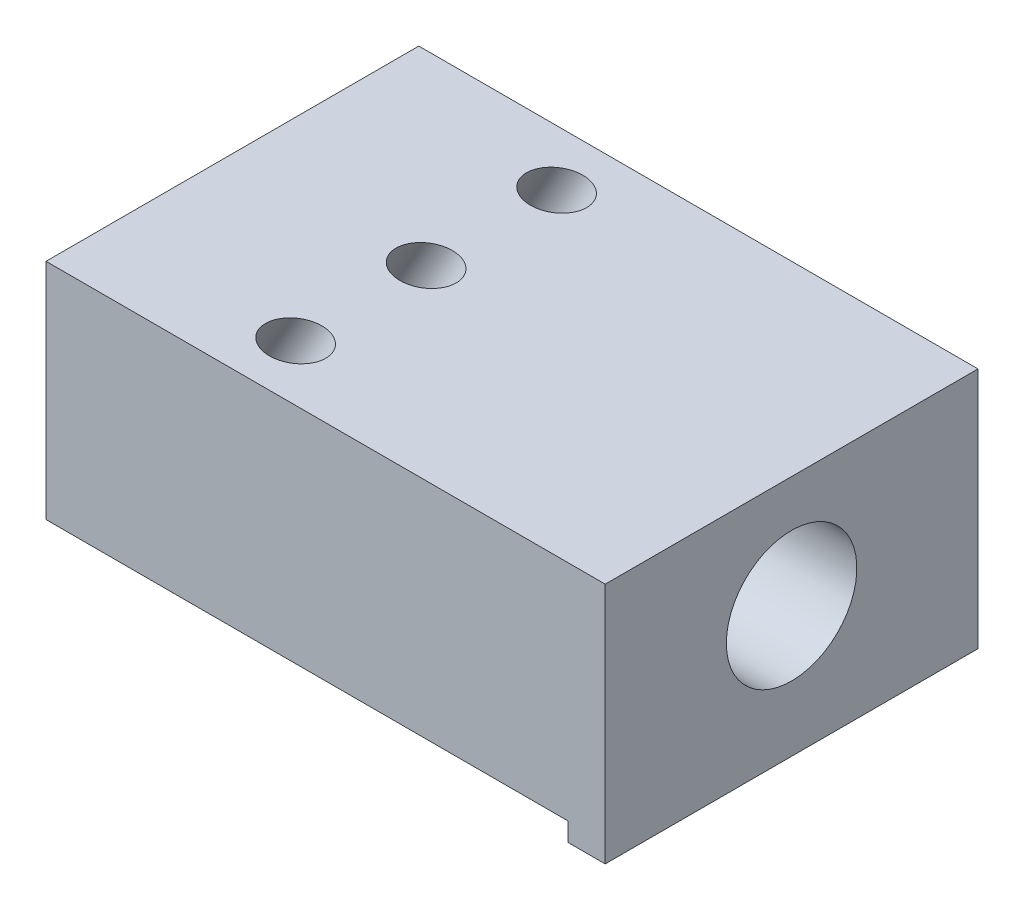
from build123d import *

# Parameters (mm, degrees)
SKICA1_W                 = 30
SKICA1_H                 = 12
SKICA1_W_2               = 2
SKICA1_H_2               = 1
P_IDAT_VYSUNUT_M1_DEPTH  = 20
SKICA2_R                 = 3.5
ODEBRAT_VYSUNUT_M1_DEPTH = 34
SKICA3_R                 = 1.4
ODEBRAT_VYSUNUT_M2_DEPTH = 34


with BuildPart() as part:
    # Skica1 → Přidat vysunutím1 (new body)
    with BuildSketch(Plane.XY):
        with Locations((15, 6)):
            Rectangle(SKICA1_W, SKICA1_H)
        with Locations((29, -0.5)):
            Rectangle(SKICA1_W_2, SKICA1_H_2)
    extrude(amount=P_IDAT_VYSUNUT_M1_DEPTH)

    # Skica2 → Odebrat vysunutím1 (cut)
    with BuildSketch(Plane.ZY):
        with Locations((10, 6)):
            Circle(SKICA2_R)
    extrude(amount=-ODEBRAT_VYSUNUT_M1_DEPTH, mode=Mode.SUBTRACT)

    # Skica3 → Odebrat vysunutím2 (cut)
    with BuildSketch(Plane(origin=(0, 0, 0), x_dir=(0, 0, -1), z_dir=(-0.500000000000001, -0.866025403784438, 0))):
        with Locations(Location((-10, 3, 0), (0, 0, 90))):
            Circle(SKICA3_R)
        with Locations(Location((-17, 3, 0), (0, 0, 270))):
            Circle(SKICA3_R)
        with Locations(Location((-3, 3, 0), (0, 0, 270))):
            Circle(SKICA3_R)
    extrude(amount=-ODEBRAT_VYSUNUT_M2_DEPTH, mode=Mode.SUBTRACT)


solid = part.part
